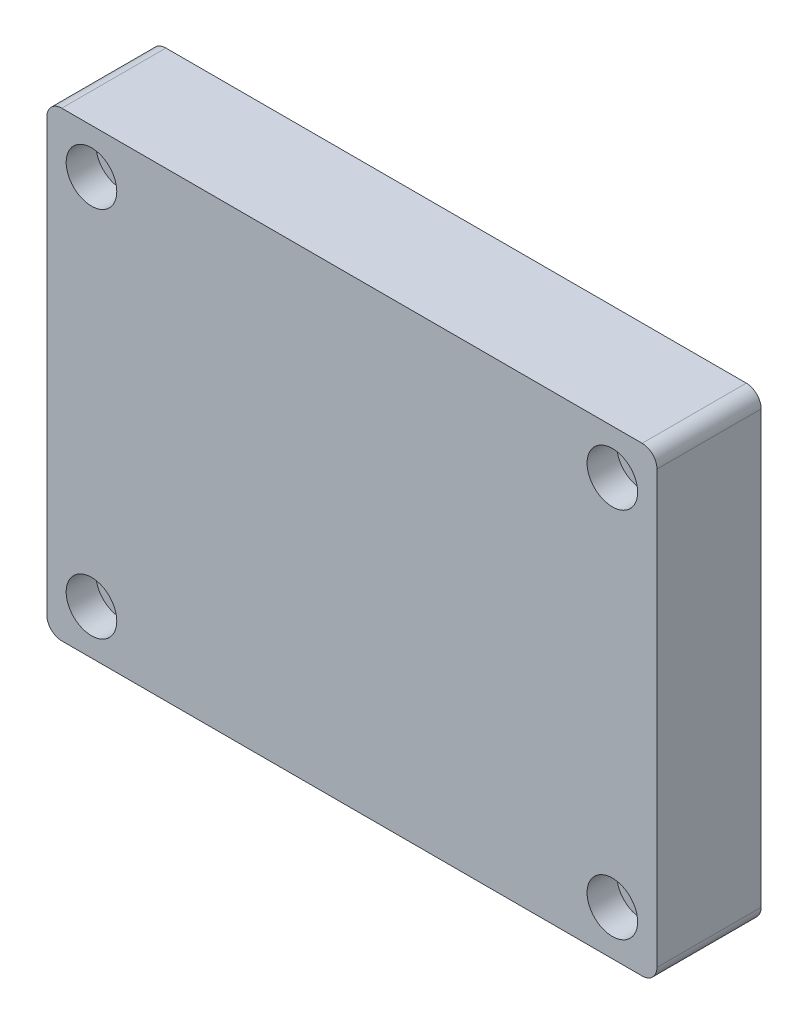
from build123d import *

# Parameters (mm, degrees)
SKETCH_1_W          = 41
SKETCH_1_H          = 31
SKETCH_1_W_2        = 31
SKETCH_1_H_2        = 21
EXTRUDE_1_DEPTH     = 4
SKETCH_2_W          = 41
SKETCH_2_H          = 31
EXTRUDE_1_2_DEPTH   = 1
CUT_EXTRUDE_START   = -5
SKETCH_3_R          = 1.7
CUT_EXTRUDE_1_DEPTH = 2
SKETCH_4_R          = 0.7
CUT_EXTRUDE_2_DEPTH = 26.874698066
FILLET_1_R          = 1
CUT_EXTRUDE_3_DEPTH = 4
EXTRUDE_2_DEPTH     = 2


with BuildPart() as part:
    # 草图1 → Extrude 1 (new body)
    with BuildSketch(Plane.XY):
        Rectangle(SKETCH_1_W, SKETCH_1_H)
        Rectangle(SKETCH_1_W_2, SKETCH_1_H_2, mode=Mode.SUBTRACT)
    extrude(amount=EXTRUDE_1_DEPTH)

    # 草图2 → Extrude 1 2 (add)
    with BuildSketch(Plane.XY.offset(4)):
        Rectangle(SKETCH_2_W, SKETCH_2_H)
    extrude(amount=EXTRUDE_1_2_DEPTH)

    # 草图3 → 切除-拉伸1 (cut)
    with BuildSketch(Plane(origin=(0, 0, 0), x_dir=(-1, 0, 0), z_dir=(0, 0, -1)).offset(CUT_EXTRUDE_START)):
        with Locations(Location((17.5, 12.5, 0), (0, 0, 180))):
            Circle(SKETCH_3_R)
        with Locations(Location((-17.5, 12.5, 0), (0, 0, 180))):
            Circle(SKETCH_3_R)
        with Locations(Location((17.5, -12.5, 0), (0, 0, 180))):
            Circle(SKETCH_3_R)
        with Locations(Location((-17.5, -12.5, 0), (0, 0, 180))):
            Circle(SKETCH_3_R)
    extrude(amount=CUT_EXTRUDE_1_DEPTH, mode=Mode.SUBTRACT)

    # 草图4 → 切除-拉伸2 (cut, through all)
    with BuildSketch(Plane.XY.offset(3)):
        with Locations((17.5, 12.5)):
            Circle(SKETCH_4_R)
        with Locations(Location((-17.5, 12.5, 0), (0, 0, 180))):
            Circle(SKETCH_4_R)
        with Locations(Location((17.5, -12.5, 0), (0, 0, 180))):
            Circle(SKETCH_4_R)
        with Locations((-17.5, -12.5)):
            Circle(SKETCH_4_R)
    extrude(amount=-CUT_EXTRUDE_2_DEPTH, mode=Mode.SUBTRACT)

    # 圆角1
    fillet_1_edges = [part.edges().sort_by_distance(p)[0] for p in [
        (20.5, -15.5, 2.5),
        (-20.5, -15.5, 2.5),
        (-20.5, 15.5, 2.5),
        (20.5, 15.5, 2.5),
    ]]
    fillet(fillet_1_edges, radius=FILLET_1_R)

    # 草图5 → 切除-拉伸3 (cut)
    with BuildSketch(Plane(origin=(0, 0, 0), x_dir=(-1, 0, 0), z_dir=(0, 0, -1))):
        Polygon((-15.5, 10.5), (-15.5, 12.5), (-15.5, 14), (15.5, 14), (15.5, 12.5), (15.5, 10.5), (17.5, 10.5), (19, 10.5), (19, -10.5), (17.5, -10.5), (15.5, -10.5), (15.5, -12.5), (15.5, -14), (-15.5, -14), (-15.5, -12.5), (-15.5, -10.5), (-17.5, -10.5), (-19, -10.5), (-19, 10.5), (-17.5, 10.5), align=None)
    extrude(amount=-CUT_EXTRUDE_3_DEPTH, mode=Mode.SUBTRACT)

    # 草图7 → 凸台-拉伸2 (add)
    with BuildSketch(Plane(origin=(0, 0, 0), x_dir=(-1, 0, 0), z_dir=(0, 0, -1))):
        with BuildLine():
            Line((-20.5, 14.5), (-20.5, -14.5))
            ThreePointArc((-20.5, -14.5), (-20.207106781, -15.207106781), (-19.5, -15.5))
            Line((-19.5, -15.5), (19.5, -15.5))
            ThreePointArc((19.5, -15.5), (20.207106781, -15.207106781), (20.5, -14.5))
            Line((20.5, -14.5), (20.5, 14.5))
            ThreePointArc((20.5, 14.5), (20.207106781, 15.207106781), (19.5, 15.5))
            Line((19.5, 15.5), (-19.5, 15.5))
            ThreePointArc((-19.5, 15.5), (-20.207106781, 15.207106781), (-20.5, 14.5))
        make_face()
        with BuildLine():
            Line((-19.5, 13.5), (-19.5, -13.5))
            ThreePointArc((-19.5, -13.5), (-19.207106781, -14.207106781), (-18.5, -14.5))
            Line((-18.5, -14.5), (18.5, -14.5))
            ThreePointArc((18.5, -14.5), (19.207106781, -14.207106781), (19.5, -13.5))
            Line((19.5, -13.5), (19.5, 13.5))
            ThreePointArc((19.5, 13.5), (19.207106781, 14.207106781), (18.5, 14.5))
            Line((18.5, 14.5), (-18.5, 14.5))
            ThreePointArc((-18.5, 14.5), (-19.207106781, 14.207106781), (-19.5, 13.5))
        make_face(mode=Mode.SUBTRACT)
    extrude(amount=EXTRUDE_2_DEPTH)


solid = part.part
